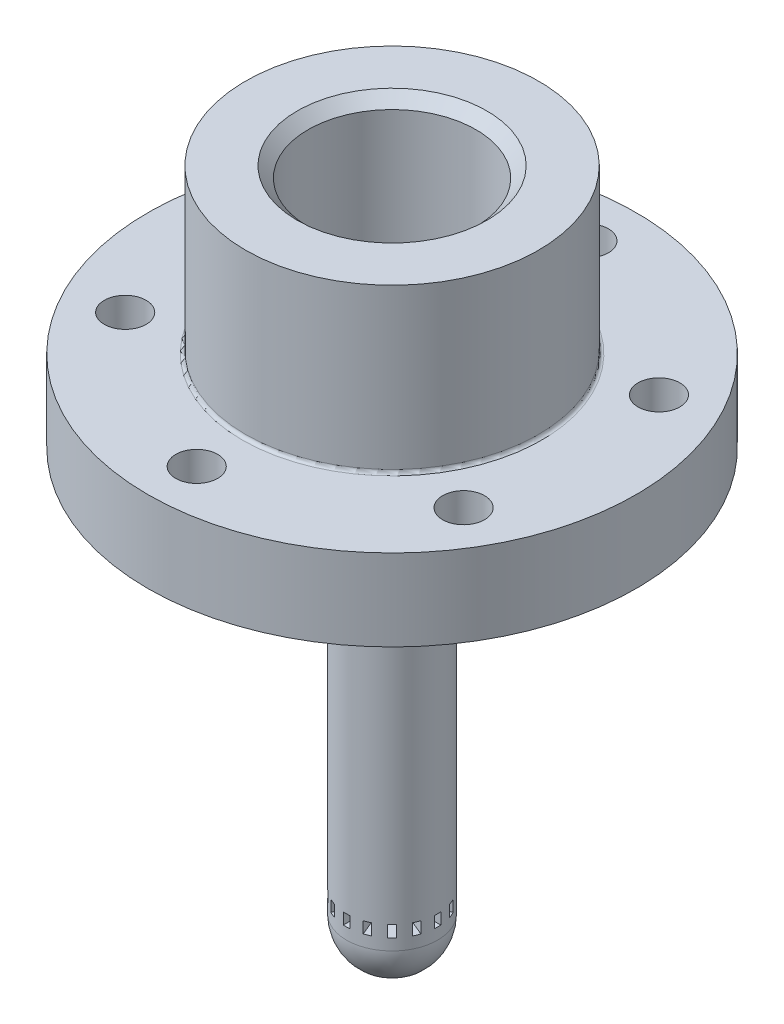
from build123d import *

# Parameters (mm, degrees)
CUT_EXTRUDE1_REACH      = 26.41
CUT_EXTRUDE1_END_RADIUS = 1.524
SKETCH2_W               = 0.508
SKETCH2_H               = 0.889
CIRPATTERN1_COUNT       = 16
SKETCH3_R               = 3.556
SKETCH3_R_2             = 1.524
BOSS_EXTRUDE1_DEPTH     = 6.35
BOSS_EXTRUDE2_START     = 6.35
SKETCH4_R               = 19.05
SKETCH4_R_2             = 1.524
BOSS_EXTRUDE2_DEPTH     = 6.35
CUT_EXTRUDE2_REACH      = 51.396
SKETCH11_R              = 1.63195
CIRPATTERN2_COUNT       = 6
CHAMFER1_SIZE           = 3.048
CHAMFER1_SIZE2          = 5.279290861
SKETCH13_R              = 11.43
SKETCH13_R_2            = 6.54812
BOSS_EXTRUDE4_DEPTH     = 12.7
FILLET4_R               = 0.254
CHAMFER2_SIZE           = 0.851662
CHAMFER2_SIZE2          = 0.83947


with BuildPart() as part:
    # Sketch1 → Revolve2 (revolve)
    with BuildSketch(Plane.XY, mode=Mode.PRIVATE) as revolve2_sk:
        with BuildLine():
            Line((-1.524, 23.078774136), (-3.556, 23.078774136))
            Line((-3.556, 23.078774136), (-3.556, -2.067225864))
            ThreePointArc((-3.556, -2.067225864), (-2.514471714, -4.581697578), (0, -5.623225864))
            Line((0, -5.623225864), (0, -1.606607061))
            ThreePointArc((0, -1.606607061), (-0.720373994, -1.97463996), (-1.524, -2.067225864))
            Line((-1.524, -2.067225864), (-1.524, 23.078774136))
        make_face()
    revolve(revolve2_sk.sketch.rotate(Axis((0, 8.215698649, 0), (0, -1, 0)), 270), axis=Axis((0, 8.215698649, 0), (0, -1, 0)))

    # Cut-Extrude1: up to this cylinder (the profile starts outside it)
    cut_extrude1_end = Plane(origin=(0, -0.733726, 0), z_dir=(0, 1, 0)) * Cylinder(CUT_EXTRUDE1_END_RADIUS, 56.868, mode=Mode.PRIVATE)
    # Sketch2 → Cut-Extrude1 (cut, up to the surface)
    with BuildSketch(Plane.ZY.offset(3.556), mode=Mode.PRIVATE) as cut_extrude1_sk1:
        with Locations((0.000240101, -0.733725864)):
            Rectangle(SKETCH2_W, SKETCH2_H)
    cut_extrude1_tool1 = extrude(cut_extrude1_sk1.sketch, amount=-CUT_EXTRUDE1_REACH, mode=Mode.PRIVATE) - cut_extrude1_end
    cut_extrude1 = cut_extrude1_tool1.solids().sort_by_distance((-3.556, -0.733726, 0.00024))[0]
    add(cut_extrude1, mode=Mode.SUBTRACT)

    # CirPattern1: Cut-Extrude1 ×16 about axis
    cirpattern1_axis = Axis((0, 0, 0), (0, 1, 0))
    for i in range(1, CIRPATTERN1_COUNT):
        add(cut_extrude1.rotate(cirpattern1_axis, i * 360 / CIRPATTERN1_COUNT), mode=Mode.SUBTRACT)

    # Sketch3 → Boss-Extrude1 (add)
    with BuildSketch(Plane(origin=(0, 23.078774136, 0), x_dir=(-1, 0, 0), z_dir=(0, -1, 0))):
        with Locations(Location((0, 0, 0), (0, 0, 270))):
            Circle(SKETCH3_R)
        with Locations(Location((0, 0, 0), (0, 0, 270))):
            Circle(SKETCH3_R_2, mode=Mode.SUBTRACT)
    extrude(amount=-BOSS_EXTRUDE1_DEPTH)

    # Sketch4 → Boss-Extrude2 (add)
    with BuildSketch(Plane(origin=(0, 29.428774136, 0), x_dir=(1, 0, 0), z_dir=(0, 1, 0)).offset(BOSS_EXTRUDE2_START)):
        with Locations(Location((0, 0, 0), (0, 0, 270))):
            Circle(SKETCH4_R)
        with Locations(Location((0, 0, 0), (0, 0, 270))):
            Circle(SKETCH4_R_2, mode=Mode.SUBTRACT)
    extrude(amount=-BOSS_EXTRUDE2_DEPTH)

    # Sketch11 → Cut-Extrude2 (cut, up to next)
    with BuildSketch(Plane(origin=(0, 35.778774136, 0), x_dir=(1, 0, 0), z_dir=(0, 1, 0)), mode=Mode.PRIVATE) as cut_extrude2_sk1:
        with Locations(Location((0, -15.24, 0), (0, 0, 270))):
            Circle(SKETCH11_R)
    cut_extrude2_tool1 = extrude(cut_extrude2_sk1.sketch, amount=-CUT_EXTRUDE2_REACH, mode=Mode.PRIVATE) & part.part
    cut_extrude2 = cut_extrude2_tool1.solids().sort_by_distance((0, 35.778774, 15.24))[0]
    add(cut_extrude2, mode=Mode.SUBTRACT)

    # CirPattern2: Cut-Extrude2 ×6 about axis
    cirpattern2_axis = Axis((0, 0, 0), (0, 1, 0))
    for i in range(1, CIRPATTERN2_COUNT):
        add(cut_extrude2.rotate(cirpattern2_axis, i * 360 / CIRPATTERN2_COUNT), mode=Mode.SUBTRACT)

    # Chamfer1
    chamfer1_edges = [part.edges().sort_by_distance(p)[0] for p in [
        (0, 35.778774136, -1.524),
    ]]
    chamfer1_side = [part.faces().sort_by_distance(p)[0] for p in [
        (0, 35.778774136, -18.511184633),
    ]]
    chamfer(chamfer1_edges, length=CHAMFER1_SIZE, length2=CHAMFER1_SIZE2, reference=chamfer1_side[0])

    # Sketch13 → Boss-Extrude4 (add)
    with BuildSketch(Plane(origin=(0, 35.778774136, 0), x_dir=(1, 0, 0), z_dir=(0, 1, 0))):
        with Locations(Location((0, 0, 0), (0, 0, 270))):
            Circle(SKETCH13_R)
        with Locations(Location((0, 0, 0), (0, 0, 270))):
            Circle(SKETCH13_R_2, mode=Mode.SUBTRACT)
    extrude(amount=BOSS_EXTRUDE4_DEPTH)

    # Fillet4
    fillet4_edges = [part.edges().sort_by_distance(p)[0] for p in [
        (0, 35.778774136, -11.43),
    ]]
    fillet(fillet4_edges, radius=FILLET4_R)

    # Chamfer2
    chamfer2_edges = [part.edges().sort_by_distance(p)[0] for p in [
        (0, 48.478774136, -6.54812),
    ]]
    chamfer2_side = [part.faces().sort_by_distance(p)[0] for p in [
        (0, 48.478774136, -11.10671078),
    ]]
    chamfer(chamfer2_edges, length=CHAMFER2_SIZE, length2=CHAMFER2_SIZE2, reference=chamfer2_side[0])


solid = part.part
